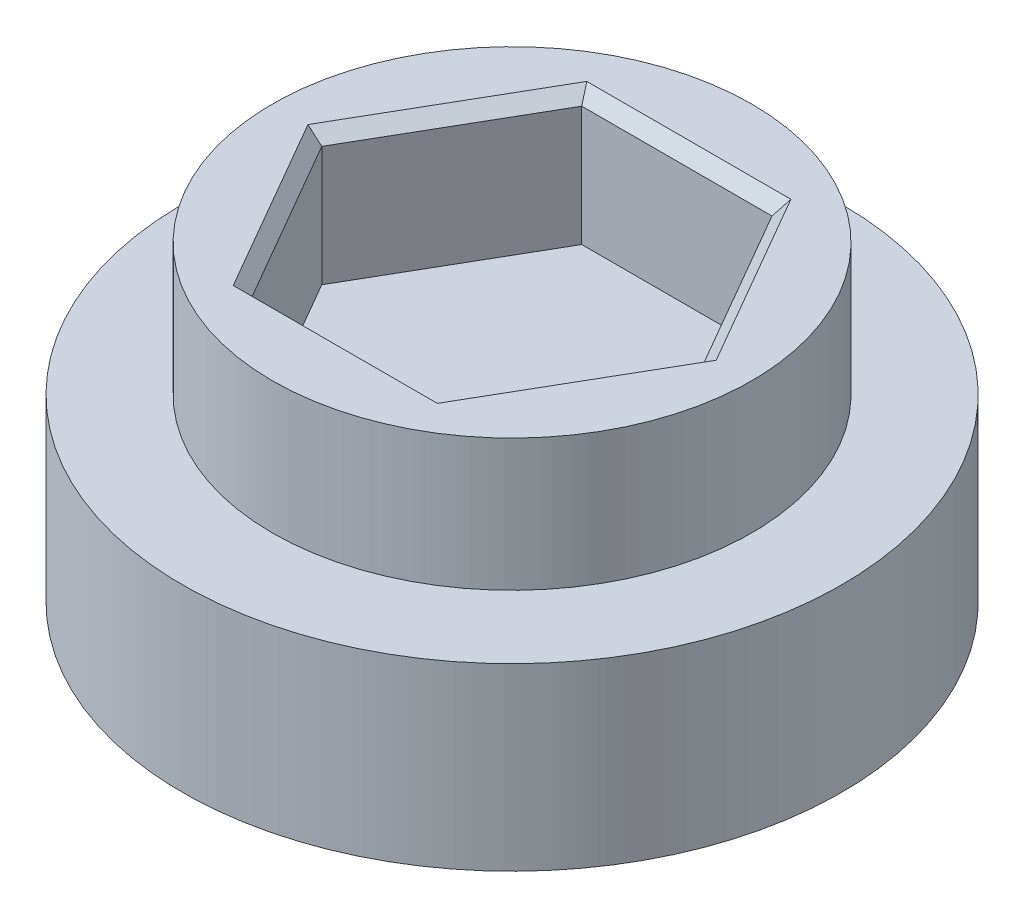
from build123d import *

# Parameters (mm, degrees)
SZKIC1_R                    = 40
DODANIE_WYCI_GNI_CIE1_DEPTH = 22
SFAZOWANIE1_SIZE            = 2
SZKIC2_R                    = 55
DODANIE_WYCI_GNI_CIE2_DEPTH = 30


with BuildPart() as part:
    # Szkic1 → Dodanie-wyciągnięcie1 (new body)
    with BuildSketch(Plane(origin=(0, 0, 0), x_dir=(1, 0, 0), z_dir=(0, 1, 0))):
        with Locations(Location((0, 0, 0), (0, 0, 270))):
            Circle(SZKIC1_R)
        Polygon((-15.877132403, 27.5), (15.877132403, 27.5), (31.754264805, 0), (15.877132403, -27.5), (-15.877132403, -27.5), (-31.754264805, 0), align=None, mode=Mode.SUBTRACT)
    extrude(amount=DODANIE_WYCI_GNI_CIE1_DEPTH)

    # Sfazowanie1
    sfazowanie1_edges = [part.edges().sort_by_distance(p)[0] for p in [
        (-23.815698604, 22, -13.75),
        (-23.815698604, 22, 13.75),
        (0, 22, 27.5),
        (23.815698604, 22, 13.75),
        (23.815698604, 22, -13.75),
        (0, 22, -27.5),
    ]]
    chamfer(sfazowanie1_edges, length=SFAZOWANIE1_SIZE)

    # Szkic2 → Dodanie-wyciągnięcie2 (add)
    with BuildSketch(Plane.XZ):
        with Locations(Location((0, 0, 0), (0, 0, 270))):
            Circle(SZKIC2_R)
    extrude(amount=DODANIE_WYCI_GNI_CIE2_DEPTH)


solid = part.part
